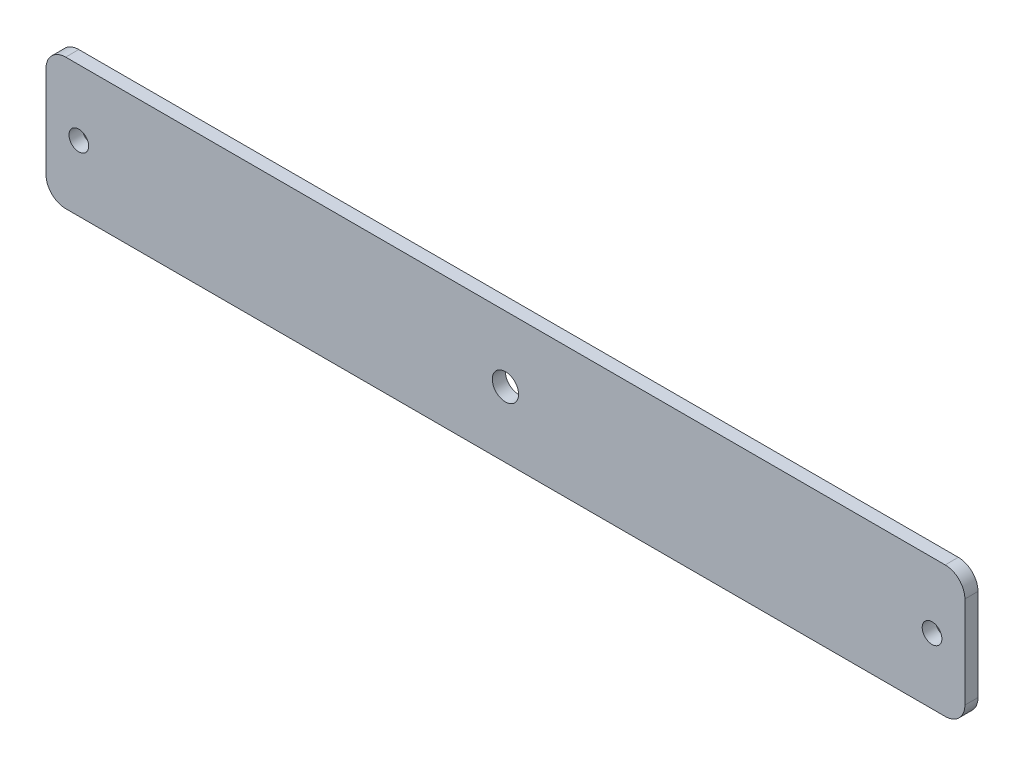
from build123d import *

# Parameters (mm, degrees)
IZIM1_R                     = 2
IZIM1_R_2                   = 1.5
Y_KSEKLIK_EKSTR_ZYON1_DEPTH = 2
RADYUS1_R                   = 3


with BuildPart() as part:
    # Çizim1 → Yükseklik-Ekstrüzyon1 (new body)
    with BuildSketch(Plane.XY):
        Polygon((0, 0), (-66.053561945, 0), (-66.053561945, 20), (73.946438055, 20), (73.946438055, 0), align=None)
        with Locations((3.946438055, 10)):
            Circle(IZIM1_R, mode=Mode.SUBTRACT)
        with Locations((-61.053561945, 10)):
            Circle(IZIM1_R_2, mode=Mode.SUBTRACT)
        with Locations((68.946438055, 10)):
            Circle(IZIM1_R_2, mode=Mode.SUBTRACT)
    extrude(amount=Y_KSEKLIK_EKSTR_ZYON1_DEPTH)

    # Radyus1
    radyus1_edges = [part.edges().sort_by_distance(p)[0] for p in [
        (-66.053561945, 0, 1),
        (-66.053561945, 20, 1),
        (73.946438055, 20, 1),
        (73.946438055, 0, 1),
    ]]
    fillet(radyus1_edges, radius=RADYUS1_R)


solid = part.part
